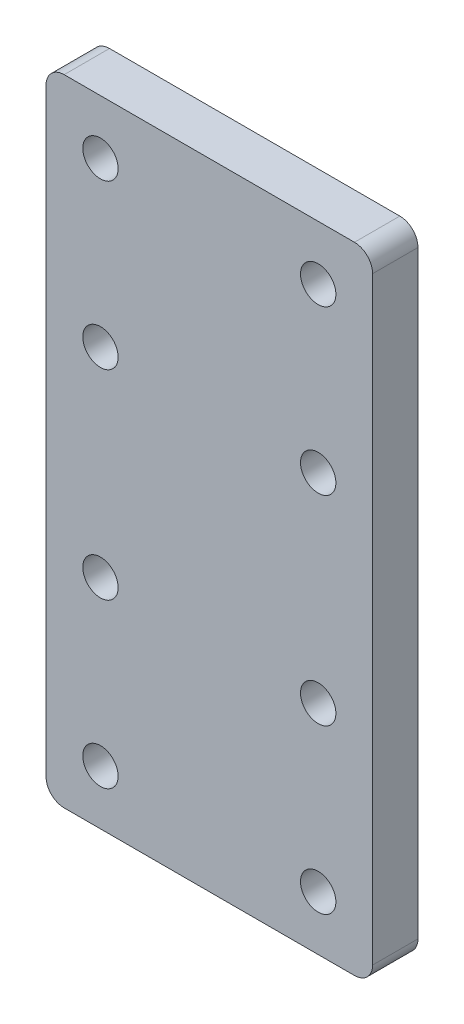
from build123d import *

# Parameters (mm, degrees)
SKETCH1_R           = 2
SKETCH1_R_2         = 1.95
SKETCH1_R_3         = 1.5
BOSS_EXTRUDE1_DEPTH = 5
SKETCH2_R           = 1.5
SKETCH2_R_2         = 1.95
SKETCH2_R_3         = 2
SKETCH2_W           = 36
SKETCH2_H           = 70
CUT_EXTRUDE1_DEPTH  = 142.509716981
FILLET1_R           = 2


with BuildPart() as part:
    # Sketch1 → Boss-Extrude1 (new body)
    with BuildSketch(Plane.XY):
        with BuildLine():
            Line((-90, 100), (-70, 100))
            Line((-70, 100), (-14.884168151, 68.505238943))
            ThreePointArc((-14.884168151, 68.505238943), (0, 64.552533207), (14.884168151, 68.505238943))
            Line((14.884168151, 68.505238943), (70, 100))
            Line((70, 100), (90, 100))
            ThreePointArc((90, 100), (97.071067812, 97.071067812), (100, 90))
            Line((100, 90), (100, 29))
            Line((100, 29), (93.372317414, 9.7797205))
            ThreePointArc((93.372317414, 9.7797205), (91.733506862, 0), (93.372317414, -9.7797205))
            Line((93.372317414, -9.7797205), (100, -29))
            Line((100, -29), (100, -90))
            ThreePointArc((100, -90), (97.071067812, -97.071067812), (90, -100))
            Line((90, -100), (70, -100))
            Line((70, -100), (14.884168151, -68.505238943))
            ThreePointArc((14.884168151, -68.505238943), (0, -64.552533207), (-14.884168151, -68.505238943))
            Line((-14.884168151, -68.505238943), (-70, -100))
            Line((-70, -100), (-90, -100))
            ThreePointArc((-90, -100), (-97.071067812, -97.071067812), (-100, -90))
            Line((-100, -90), (-100, -29))
            Line((-100, -29), (-93.372317414, -9.7797205))
            ThreePointArc((-93.372317414, -9.7797205), (-91.733506862, 0), (-93.372317414, 9.7797205))
            Line((-93.372317414, 9.7797205), (-100, 29))
            Line((-100, 29), (-100, 90))
            ThreePointArc((-100, 90), (-97.071067812, 97.071067812), (-90, 100))
        make_face()
        with Locations((-91.923881554, 91.923881554)):
            Circle(SKETCH1_R, mode=Mode.SUBTRACT)
        with Locations((91.923881554, 91.923881554)):
            Circle(SKETCH1_R, mode=Mode.SUBTRACT)
        with Locations((91.923881554, -91.923881554)):
            Circle(SKETCH1_R, mode=Mode.SUBTRACT)
        with Locations((-91.923881554, -91.923881554)):
            Circle(SKETCH1_R, mode=Mode.SUBTRACT)
        with Locations((58, 29)):
            Circle(SKETCH1_R_2, mode=Mode.SUBTRACT)
        with Locations((82, 29)):
            Circle(SKETCH1_R_2, mode=Mode.SUBTRACT)
        with Locations((58, 11)):
            Circle(SKETCH1_R_2, mode=Mode.SUBTRACT)
        with Locations((82, 11)):
            Circle(SKETCH1_R_2, mode=Mode.SUBTRACT)
        with Locations((58, -11)):
            Circle(SKETCH1_R_2, mode=Mode.SUBTRACT)
        with Locations((58, -29)):
            Circle(SKETCH1_R_2, mode=Mode.SUBTRACT)
        with Locations((82, -11)):
            Circle(SKETCH1_R_2, mode=Mode.SUBTRACT)
        with Locations((82, -29)):
            Circle(SKETCH1_R_2, mode=Mode.SUBTRACT)
        with Locations((-82, 29)):
            Circle(SKETCH1_R_2, mode=Mode.SUBTRACT)
        with Locations((-58, 29)):
            Circle(SKETCH1_R_2, mode=Mode.SUBTRACT)
        with Locations((-82, 11)):
            Circle(SKETCH1_R_2, mode=Mode.SUBTRACT)
        with Locations((-58, 11)):
            Circle(SKETCH1_R_2, mode=Mode.SUBTRACT)
        with Locations((-82, -11)):
            Circle(SKETCH1_R_2, mode=Mode.SUBTRACT)
        with Locations((-82, -29)):
            Circle(SKETCH1_R_2, mode=Mode.SUBTRACT)
        with Locations((-58, -11)):
            Circle(SKETCH1_R_2, mode=Mode.SUBTRACT)
        with Locations((-58, -29)):
            Circle(SKETCH1_R_2, mode=Mode.SUBTRACT)
        with Locations((-6, 10)):
            Circle(SKETCH1_R_3, mode=Mode.SUBTRACT)
        with Locations((6, 10)):
            Circle(SKETCH1_R_3, mode=Mode.SUBTRACT)
        with Locations((-6, -10)):
            Circle(SKETCH1_R_3, mode=Mode.SUBTRACT)
        with Locations((6, -10)):
            Circle(SKETCH1_R_3, mode=Mode.SUBTRACT)
    extrude(amount=BOSS_EXTRUDE1_DEPTH)

    # Sketch2 → Cut-Extrude1 (cut, through all)
    with BuildSketch(Plane.XY.offset(5)):
        with BuildLine():
            Line((100, 29), (100, 90))
            ThreePointArc((100, 90), (97.071067812, 97.071067812), (90, 100))
            Line((90, 100), (70, 100))
            Line((70, 100), (14.884168151, 68.505238943))
            ThreePointArc((14.884168151, 68.505238943), (0, 64.552533207), (-14.884168151, 68.505238943))
            Line((-14.884168151, 68.505238943), (-70, 100))
            Line((-70, 100), (-90, 100))
            ThreePointArc((-90, 100), (-97.071067812, 97.071067812), (-100, 90))
            Line((-100, 90), (-100, 29))
            Line((-100, 29), (-93.372317414, 9.7797205))
            ThreePointArc((-93.372317414, 9.7797205), (-91.733506862, 0), (-93.372317414, -9.7797205))
            Line((-93.372317414, -9.7797205), (-100, -29))
            Line((-100, -29), (-100, -90))
            ThreePointArc((-100, -90), (-97.071067812, -97.071067812), (-90, -100))
            Line((-90, -100), (-70, -100))
            Line((-70, -100), (-14.884168151, -68.505238943))
            ThreePointArc((-14.884168151, -68.505238943), (0, -64.552533207), (14.884168151, -68.505238943))
            Line((14.884168151, -68.505238943), (70, -100))
            Line((70, -100), (90, -100))
            ThreePointArc((90, -100), (97.071067812, -97.071067812), (100, -90))
            Line((100, -90), (100, -29))
            Line((100, -29), (93.372317414, -9.7797205))
            ThreePointArc((93.372317414, -9.7797205), (91.733506862, 0), (93.372317414, 9.7797205))
            Line((93.372317414, 9.7797205), (100, 29))
        make_face()
        with Locations((-6, 10)):
            Circle(SKETCH2_R, mode=Mode.SUBTRACT)
        with Locations((58, -11)):
            Circle(SKETCH2_R_2, mode=Mode.SUBTRACT)
        with Locations((58, 29)):
            Circle(SKETCH2_R_2, mode=Mode.SUBTRACT)
        with Locations((-91.923881554, 91.923881554)):
            Circle(SKETCH2_R_3, mode=Mode.SUBTRACT)
        with Locations((91.923881554, 91.923881554)):
            Circle(SKETCH2_R_3, mode=Mode.SUBTRACT)
        with Locations((82, 29)):
            Circle(SKETCH2_R_2, mode=Mode.SUBTRACT)
        with Locations((58, -29)):
            Circle(SKETCH2_R_2, mode=Mode.SUBTRACT)
        with Locations((6, 10)):
            Circle(SKETCH2_R, mode=Mode.SUBTRACT)
        with Locations((6, -10)):
            Circle(SKETCH2_R, mode=Mode.SUBTRACT)
        with Locations((82, -29)):
            Circle(SKETCH2_R_2, mode=Mode.SUBTRACT)
        with Locations((82, 11)):
            Circle(SKETCH2_R_2, mode=Mode.SUBTRACT)
        with Locations((-70, 0)):
            Rectangle(SKETCH2_W, SKETCH2_H, mode=Mode.SUBTRACT)
    extrude(amount=-CUT_EXTRUDE1_DEPTH, mode=Mode.SUBTRACT)

    # Fillet1
    fillet1_edges = [part.edges().sort_by_distance(p)[0] for p in [
        (-52, -35, 2.5),
        (-52, 35, 2.5),
        (-88, 35, 2.5),
        (-88, -35, 2.5),
    ]]
    fillet(fillet1_edges, radius=FILLET1_R)


solid = part.part
